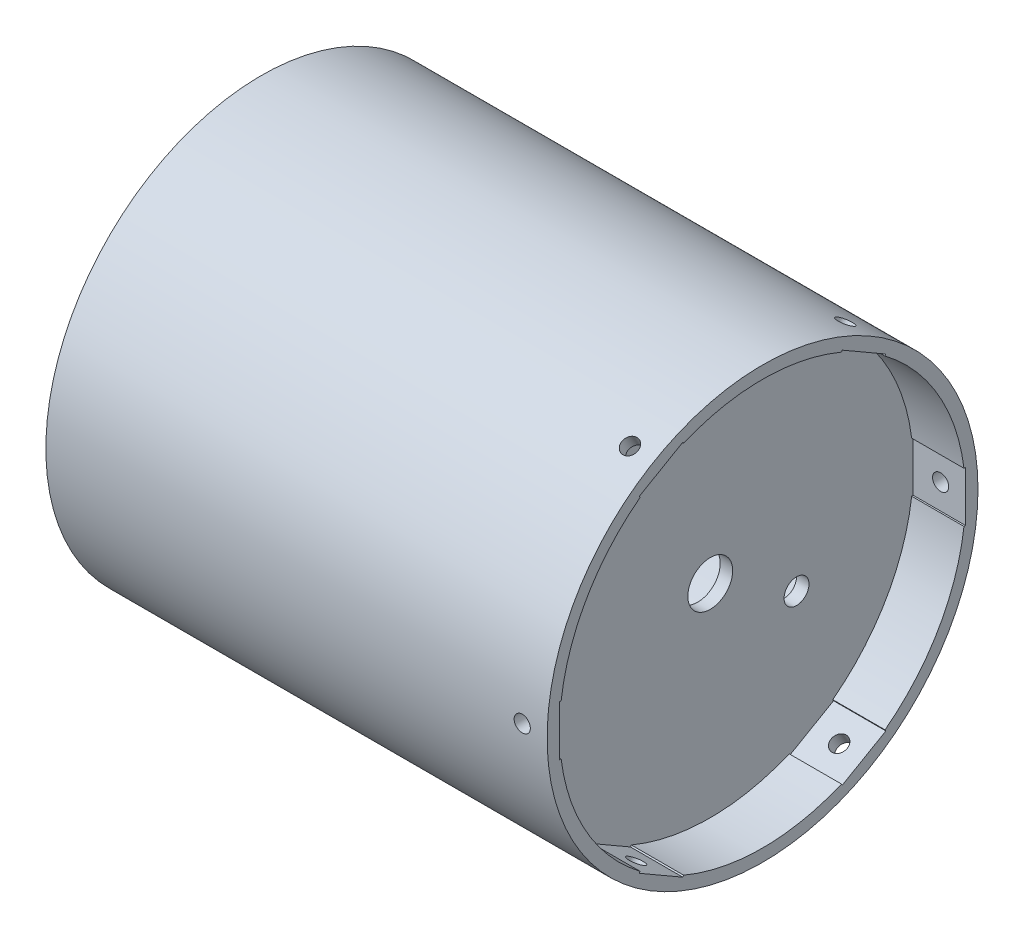
from build123d import *

# Parameters (mm, degrees)
SZKIC1_W                   = 5
SZKIC1_H                   = 5
SZKIC1_W_2                 = 21
SZKIC1_W_3                 = 175.265013497
SZKIC1_H_2                 = 81.5
SZKIC7_R                   = 3.25
WYTNIJ_WYCI_GNI_CIE1_DEPTH = 100
SZYK_KO_OWY1_COUNT         = 6
WYTNIJ_WYCI_GNI_CIE3_DEPTH = 21
SZYK_KO_OWY2_COUNT         = 6
WYTNIJ_WYCI_GNI_CIE2_REACH = 219.853
SZKIC8_R                   = 9
SZKIC8_R_2                 = 5


with BuildPart() as part:
    # Szkic1 → Obrót1 (revolve)
    with BuildSketch(Plane.XY, mode=Mode.PRIVATE) as obr_t1_sk:
        with Locations((2.5, 84)):
            Rectangle(SZKIC1_W, SZKIC1_H)
        with Locations((15.5, 84)):
            Rectangle(SZKIC1_W_2, SZKIC1_H)
        with Locations((-87.632506749, 84)):
            Rectangle(SZKIC1_W_3, SZKIC1_H)
        with Locations((2.5, 40.75)):
            Rectangle(SZKIC1_W, SZKIC1_H_2)
    revolve(obr_t1_sk.sketch.rotate(Axis((5, 0, 0), (-1, 0, 0)), 90), axis=Axis((5, 0, 0), (-1, 0, 0)))

    # Szkic7 → Wytnij-wyciągnięcie1 (cut)
    with BuildSketch(Plane.XY):
        with Locations(Location((16, 0, 0), (0, 0, 180))):
            Circle(SZKIC7_R)
    wytnij_wyci_gni_cie1 = extrude(amount=WYTNIJ_WYCI_GNI_CIE1_DEPTH, mode=Mode.SUBTRACT)

    # Szyk kołowy1: Wytnij-wyciągnięcie1 ×6 about axis
    szyk_ko_owy1_axis = Axis((26, 0, 0), (1, 0, 0))
    for i in range(1, SZYK_KO_OWY1_COUNT):
        add(wytnij_wyci_gni_cie1.rotate(szyk_ko_owy1_axis, i * 360 / SZYK_KO_OWY1_COUNT), mode=Mode.SUBTRACT)

    # Szkic9 → Wytnij-wyciągnięcie3 (cut)
    with BuildSketch(Plane(origin=(26, 0, 0), x_dir=(0, 0, -1), z_dir=(1, 0, 0))):
        Polygon((-81.5, 0), (-81.5, 10.1), (-77.682544911, 10.1), (-77.682544911, -10.1), (-81.5, -10.1), align=None)
    wytnij_wyci_gni_cie3 = extrude(amount=-WYTNIJ_WYCI_GNI_CIE3_DEPTH, mode=Mode.SUBTRACT)

    # Szyk kołowy2: Wytnij-wyciągnięcie3 ×6 about axis
    szyk_ko_owy2_axis = Axis((0, 0, 0), (1, 0, 0))
    for i in range(1, SZYK_KO_OWY2_COUNT):
        add(wytnij_wyci_gni_cie3.rotate(szyk_ko_owy2_axis, i * 360 / SZYK_KO_OWY2_COUNT), mode=Mode.SUBTRACT)

    # Szkic8 → Wytnij-wyciągnięcie2 (cut, up to next)
    with BuildSketch(Plane(origin=(5, 0, 0), x_dir=(0, 0, -1), z_dir=(1, 0, 0)), mode=Mode.PRIVATE) as wytnij_wyci_gni_cie2_sk1:
        Circle(SZKIC8_R)
    wytnij_wyci_gni_cie2_tool1 = extrude(wytnij_wyci_gni_cie2_sk1.sketch, amount=-WYTNIJ_WYCI_GNI_CIE2_REACH, mode=Mode.PRIVATE) & part.part
    # Szkic8 → Wytnij-wyciągnięcie2 (cut, up to next)
    with BuildSketch(Plane(origin=(5, 0, 0), x_dir=(0, 0, -1), z_dir=(1, 0, 0)), mode=Mode.PRIVATE) as wytnij_wyci_gni_cie2_sk2:
        with Locations((34.641016151, -20)):
            Circle(SZKIC8_R_2)
    wytnij_wyci_gni_cie2_tool2 = extrude(wytnij_wyci_gni_cie2_sk2.sketch, amount=-WYTNIJ_WYCI_GNI_CIE2_REACH, mode=Mode.PRIVATE) & part.part
    add(wytnij_wyci_gni_cie2_tool1.solids().sort_by_distance((5, 0, 0))[0], mode=Mode.SUBTRACT)
    add(wytnij_wyci_gni_cie2_tool2.solids().sort_by_distance((5, -20, -34.641016))[0], mode=Mode.SUBTRACT)


solid = part.part
